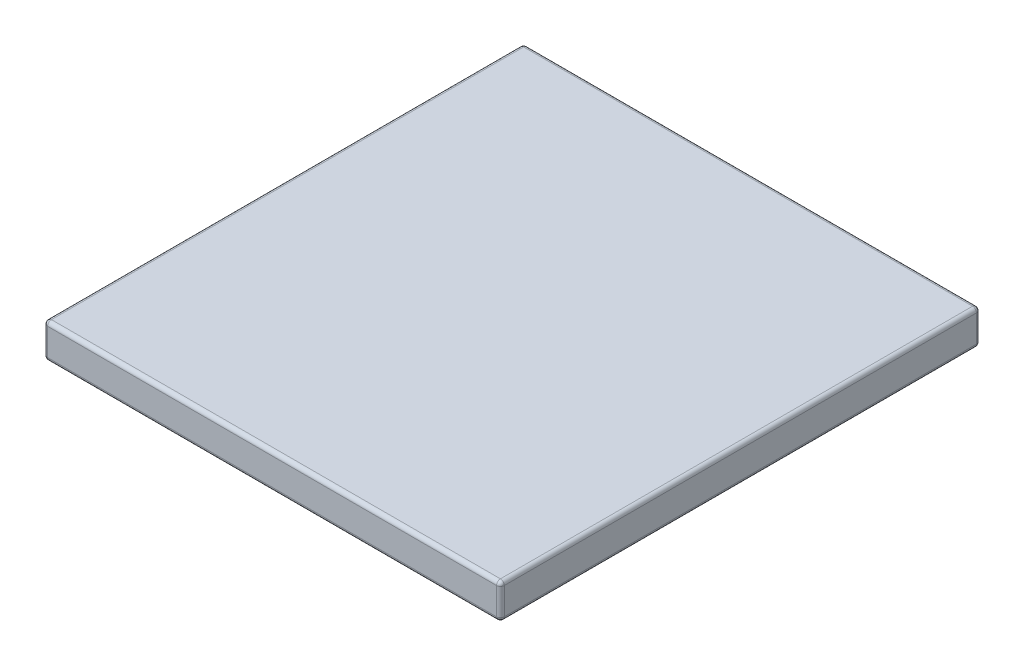
from build123d import *

# Parameters (mm, degrees)
SKETCH_1_W      = 59.1
SKETCH_1_H      = 62.1
EXTRUDE_1_DEPTH = 4.5
FILLET_1_R      = 0.5


with BuildPart() as part:
    # 스케치1 → 보스-돌출1 (new body)
    with BuildSketch(Plane(origin=(0, 0, 0), x_dir=(1, 0, 0), z_dir=(0, 1, 0))):
        Rectangle(SKETCH_1_W, SKETCH_1_H)
    extrude(amount=-EXTRUDE_1_DEPTH)

    # 필렛1
    fillet_1_edges = [part.edges().sort_by_distance(p)[0] for p in [
        (29.55, -4.5, 0),
        (0, -4.5, -31.05),
        (-29.55, -4.5, 0),
        (0, 0, -31.05),
        (29.55, 0, 0),
        (0, 0, 31.05),
        (-29.55, 0, 0),
        (0, -4.5, 31.05),
        (-29.55, -2.25, -31.05),
        (29.55, -2.25, -31.05),
        (29.55, -2.25, 31.05),
        (-29.55, -2.25, 31.05),
    ]]
    fillet(fillet_1_edges, radius=FILLET_1_R)


solid = part.part
